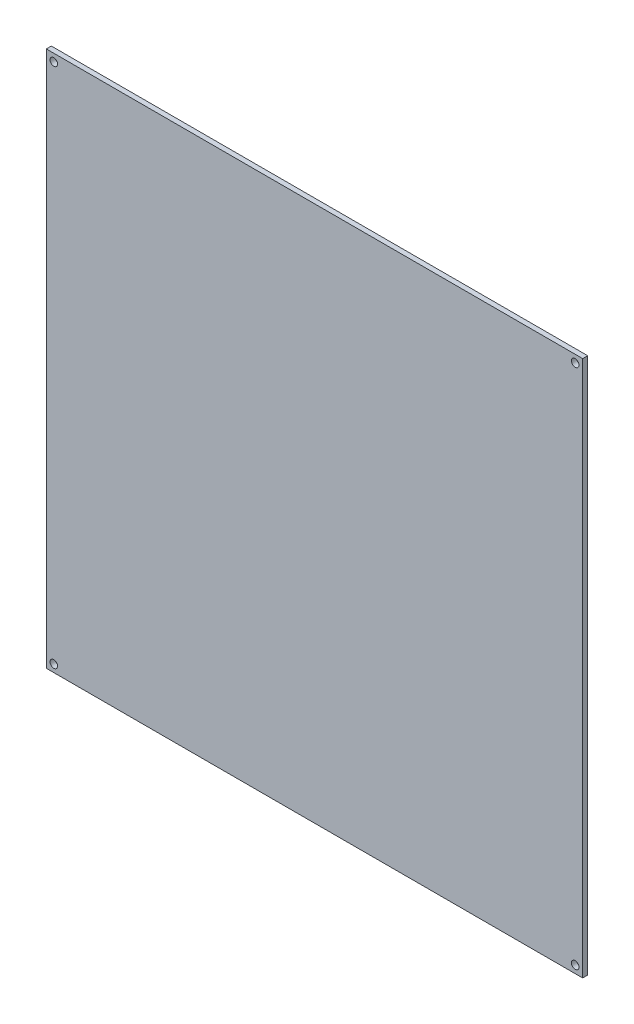
from build123d import *

# Parameters (mm, degrees)
SKETCH_1_W      = 214
SKETCH_1_H      = 214
SKETCH_1_R      = 1.5
EXTRUDE_1_DEPTH = 2


with BuildPart() as part:
    # 草图1 → 凸台-拉伸1 (new body)
    with BuildSketch(Plane.XY):
        Rectangle(SKETCH_1_W, SKETCH_1_H)
        with Locations((104, -104)):
            Circle(SKETCH_1_R, mode=Mode.SUBTRACT)
        with Locations((104, 104)):
            Circle(SKETCH_1_R, mode=Mode.SUBTRACT)
        with Locations((-104, 104)):
            Circle(SKETCH_1_R, mode=Mode.SUBTRACT)
        with Locations((-104, -104)):
            Circle(SKETCH_1_R, mode=Mode.SUBTRACT)
    extrude(amount=EXTRUDE_1_DEPTH)


solid = part.part
